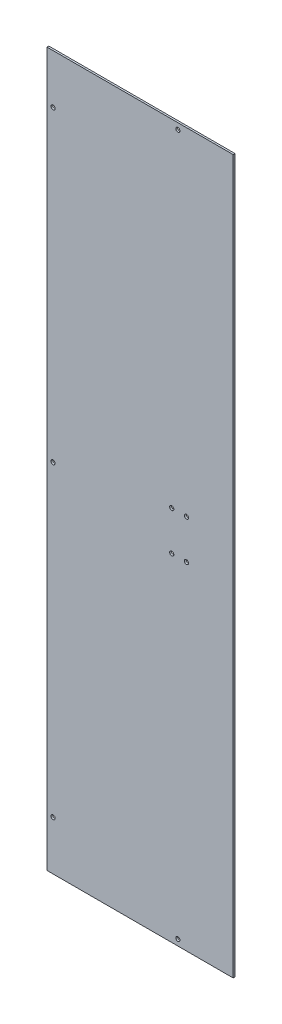
from build123d import *

# Parameters (mm, degrees)
MAIN_PROFILE_SKETCH_W = 151.5
MAIN_PROFILE_SKETCH_H = 580
MAIN_PROFILE_SKETCH_R = 1.7
MAIN_EXTRUSION_DEPTH  = 1.5


with BuildPart() as part:
    # Main Profile Sketch → Main Extrusion (new body)
    with BuildSketch(Plane.XY.offset(111.5)):
        with Locations((159.25, 0)):
            Rectangle(MAIN_PROFILE_SKETCH_W, MAIN_PROFILE_SKETCH_H)
        with Locations((88.5, -250)):
            Circle(MAIN_PROFILE_SKETCH_R, mode=Mode.SUBTRACT)
        with Locations((190, -285)):
            Circle(MAIN_PROFILE_SKETCH_R, mode=Mode.SUBTRACT)
        with Locations((185, -16)):
            Circle(MAIN_PROFILE_SKETCH_R, mode=Mode.SUBTRACT)
        with Locations((197, -16)):
            Circle(MAIN_PROFILE_SKETCH_R, mode=Mode.SUBTRACT)
        with Locations((88.5, 0)):
            Circle(MAIN_PROFILE_SKETCH_R, mode=Mode.SUBTRACT)
        with Locations((88.5, 250)):
            Circle(MAIN_PROFILE_SKETCH_R, mode=Mode.SUBTRACT)
        with Locations((185, 16)):
            Circle(MAIN_PROFILE_SKETCH_R, mode=Mode.SUBTRACT)
        with Locations((197, 16)):
            Circle(MAIN_PROFILE_SKETCH_R, mode=Mode.SUBTRACT)
        with Locations((190, 285)):
            Circle(MAIN_PROFILE_SKETCH_R, mode=Mode.SUBTRACT)
    extrude(amount=-MAIN_EXTRUSION_DEPTH)


solid = part.part
